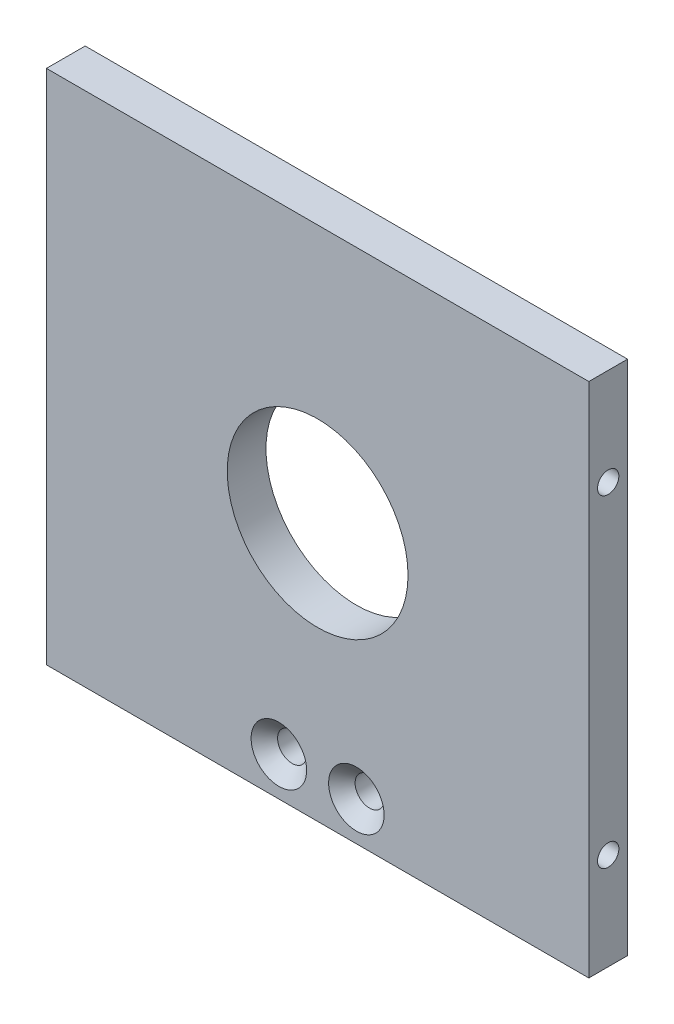
from build123d import *

# Parameters (mm, degrees)
SKETCH_1_W                  = 84
SKETCH_1_H                  = 80
SKETCH_1_R                  = 14
EXTRUDE_1_DEPTH             = 3
HOLE_WIZARD_M4_1_AT_2_COUNT = 2
HOLE_WIZARD_M4_1_AT_2_PITCH = 50
HOLE_WIZARD_1_D             = 4.5
HOLE_WIZARD_1_DEPTH         = 10
HOLE_WIZARD_1_CSINK_D       = 8.6
HOLE_WIZARD_1_CSINK_ANGLE   = 90
HOLE_WIZARD_1_TIP           = 1.351936393


with BuildPart() as part:
    # 草图1 → 凸台-拉伸1 (new, symmetric)
    with BuildSketch(Plane.XY):
        Rectangle(SKETCH_1_W, SKETCH_1_H)
        Circle(SKETCH_1_R, mode=Mode.SUBTRACT)
    extrude(amount=EXTRUDE_1_DEPTH, both=True)

    # 草图4 → M4 螺纹孔1 (revolve, cut)
    with BuildSketch(Plane(origin=(-42, 25, 0), x_dir=(0, 0, 1), z_dir=(0, 1, 0))):
        Polygon((0, 0), (0, 12.491420021), (1.65, 11.5), (1.65, 0), align=None)
    hole_wizard_m4_1 = revolve(axis=Axis((-48.35, 25, 0), (1, 0, 0)), mode=Mode.SUBTRACT)

    # M4 螺纹孔1 at 2: M4 螺纹孔1 ×2
    with Locations(*[(0, -i * HOLE_WIZARD_M4_1_AT_2_PITCH, 0) for i in range(1, HOLE_WIZARD_M4_1_AT_2_COUNT)]):
        add(hole_wizard_m4_1, mode=Mode.SUBTRACT)

    # 镜向1: M4 螺纹孔1 across plane
    add(hole_wizard_m4_1.mirror(Plane(origin=(0, 0, 0), x_dir=(0, 0, 1), z_dir=(1, 0, 0))), mode=Mode.SUBTRACT)

    # 镜向1 copy 1 sketch → 镜向1 copy 1 (revolve, cut)
    with BuildSketch(Plane(origin=(42, -25, 0), x_dir=(0, 0, 1), z_dir=(0, 1, 0))):
        Polygon((0, 0), (0, -12.491420021), (1.65, -11.5), (1.65, 0), align=None)
    revolve(axis=Axis((48.35, -25, 0), (1, 0, 0)), mode=Mode.SUBTRACT)

    # 打孔尺寸(%根据十字)槽沉头木螺钉的类型1
    with Locations(Plane(origin=(0, 0, 3), x_dir=(-1, 0, 0), z_dir=(0, 0, 1))):
        with Locations((6, 34), (-6, 34)):
            CounterSinkHole(HOLE_WIZARD_1_D / 2, HOLE_WIZARD_1_CSINK_D / 2, depth=HOLE_WIZARD_1_DEPTH, counter_sink_angle=HOLE_WIZARD_1_CSINK_ANGLE)
            with Locations((0, 0, -(HOLE_WIZARD_1_DEPTH + HOLE_WIZARD_1_TIP / 2))):  # 118° drill point
                Cone(0, HOLE_WIZARD_1_D / 2, HOLE_WIZARD_1_TIP, mode=Mode.SUBTRACT)


solid = part.part
